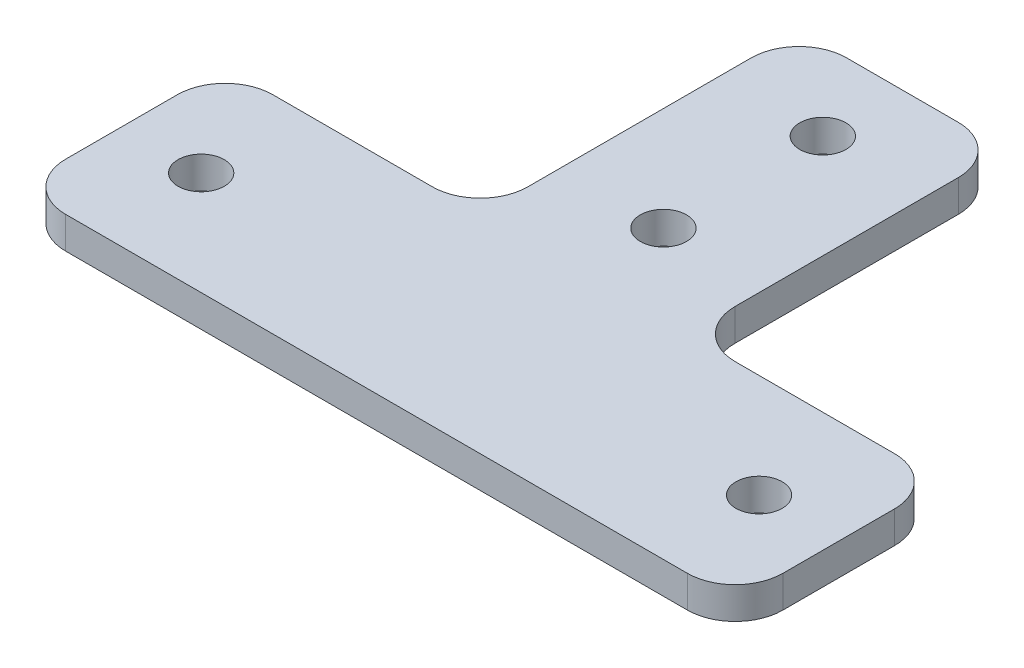
from build123d import *

# Parameters (mm, degrees)
SKETCH_1_R      = 1.45
EXTRUDE_1_DEPTH = 2
FILLET_1_R      = 3


with BuildPart() as part:
    # 草图1 → 凸台-拉伸1 (new body)
    with BuildSketch(Plane(origin=(0, 0, 0), x_dir=(1, 0, 0), z_dir=(0, 1, 0))):
        Polygon((-22.5, 6.5), (-22.5, -6.5), (22.5, -6.5), (22.5, 6.5), (6.5, 6.5), (6.5, 26.5), (-6.5, 26.5), (-6.5, 6.5), align=None)
        with Locations(Location((-17.5, 0, 0), (0, 0, 270))):
            Circle(SKETCH_1_R, mode=Mode.SUBTRACT)
        with Locations(Location((17.5, 0, 0), (0, 0, 270))):
            Circle(SKETCH_1_R, mode=Mode.SUBTRACT)
        with Locations(Location((0, 11.5, 0), (0, 0, 270))):
            Circle(SKETCH_1_R, mode=Mode.SUBTRACT)
        with Locations(Location((0, 21.5, 0), (0, 0, 270))):
            Circle(SKETCH_1_R, mode=Mode.SUBTRACT)
    extrude(amount=EXTRUDE_1_DEPTH)

    # 圆角1
    fillet_1_edges = [part.edges().sort_by_distance(p)[0] for p in [
        (22.5, 1, -6.5),
        (22.5, 1, 6.5),
        (-22.5, 1, 6.5),
        (-22.5, 1, -6.5),
        (-6.5, 1, -6.5),
        (-6.5, 1, -26.5),
        (6.5, 1, -26.5),
        (6.5, 1, -6.5),
    ]]
    fillet(fillet_1_edges, radius=FILLET_1_R)


solid = part.part
